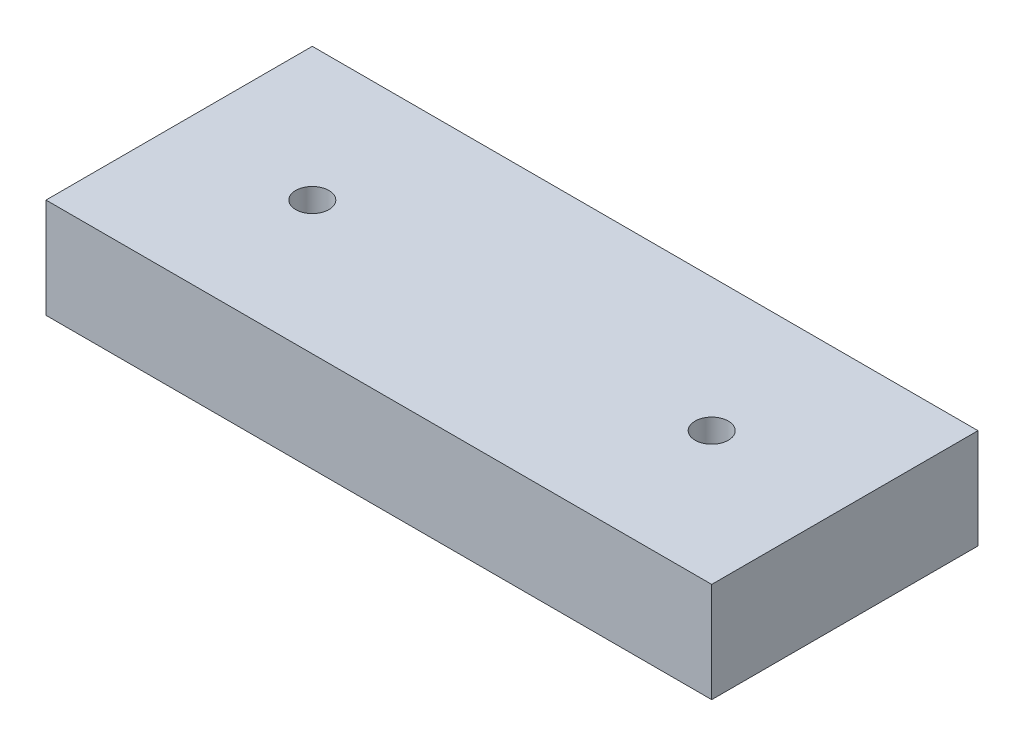
from build123d import *

# Parameters (mm, degrees)
SKETCH1_W           = 20
SKETCH1_H           = 8
BOSS_EXTRUDE1_DEPTH = 3
SKETCH4_R           = 0.5
CUT_EXTRUDE1_DEPTH  = 22.748563171


with BuildPart() as part:
    # Sketch1 → Boss-Extrude1 (new body)
    with BuildSketch(Plane(origin=(0, 0, 0), x_dir=(1, 0, 0), z_dir=(0, 1, 0))):
        with Locations((-10, 4)):
            Rectangle(SKETCH1_W, SKETCH1_H)
    extrude(amount=BOSS_EXTRUDE1_DEPTH)

    # Sketch4 → Cut-Extrude1 (cut, through all)
    with BuildSketch(Plane(origin=(0, 3, 0), x_dir=(1, 0, 0), z_dir=(0, 1, 0))):
        with Locations(Location((-16, 4, 0), (0, 0, 270))):
            Circle(SKETCH4_R)
        with Locations(Location((-4, 4, 0), (0, 0, 270))):
            Circle(SKETCH4_R)
    extrude(amount=-CUT_EXTRUDE1_DEPTH, mode=Mode.SUBTRACT)


solid = part.part
